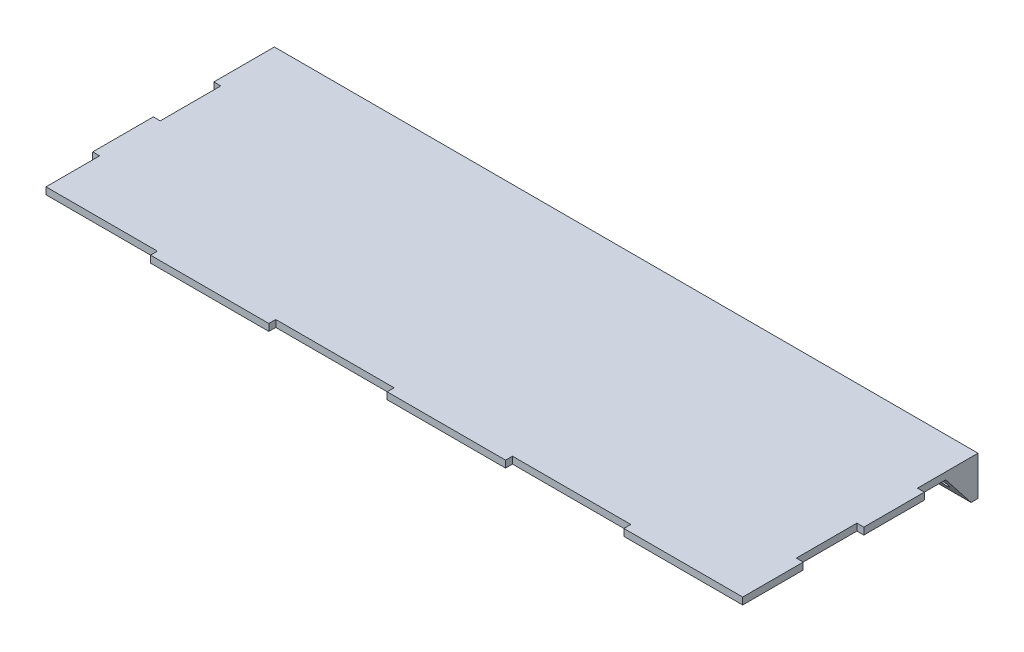
from build123d import *

# Parameters (mm, degrees)
EXTRUDE_1_DEPTH     = 3
SKETCH_3_W          = 51.3
SKETCH_3_H          = 3
CUT_EXTRUDE_2_DEPTH = 3
SKETCH_4_W          = 4
SKETCH_4_H          = 28
SKETCH_4_W_2        = 14
SKETCH_4_H_2        = 14
EXTRUDE_2_DEPTH     = 14
CUT_EXTRUDE_3_DEPTH = 14
CUT_EXTRUDE_4_DEPTH = 14
CUT_EXTRUDE_5_DEPTH = 14
CUT_EXTRUDE_6_REACH = 216.55
SKETCH_9_R          = 2.5


with BuildPart() as part:
    # Эскиз1 → Бобышка-Вытянуть1 (new body)
    with BuildSketch(Plane(origin=(0, 0, 0), x_dir=(1, 0, 0), z_dir=(0, 1, 0))):
        Polygon((-121.424018304, 15.144551695), (-121.424018304, 41.394551695), (183.575981696, 41.394551695), (183.575981696, 15.144551695), (186.575981696, 15.144551695), (186.575981696, -11.105448305), (183.575981696, -11.105448305), (183.575981696, -37.355448305), (186.575981696, -37.355448305), (186.575981696, -63.605448305), (-118.424018304, -63.605448305), (-118.424018304, -37.355448305), (-121.424018304, -37.355448305), (-121.424018304, -11.105448305), (-118.424018304, -11.105448305), (-118.424018304, 15.144551695), align=None)
    extrude(amount=EXTRUDE_1_DEPTH)

    # Эскиз3 → Вырез-Вытянуть2 (cut)
    with BuildSketch(Plane(origin=(0, 3, 0), x_dir=(1, 0, 0), z_dir=(0, 1, 0))):
        with Locations((-95.774018304, -62.105448305)):
            Rectangle(SKETCH_3_W, SKETCH_3_H)
        with Locations((6.825981696, -62.105448305)):
            Rectangle(SKETCH_3_W, SKETCH_3_H)
        with Locations((109.425981696, -62.105448305)):
            Rectangle(SKETCH_3_W, SKETCH_3_H)
    extrude(amount=-CUT_EXTRUDE_2_DEPTH, mode=Mode.SUBTRACT)

    # Эскиз4 → Бобышка-Вытянуть2 (add)
    with BuildSketch(Plane.XZ):
        with Locations((27.575981696, -27.394551695)):
            Rectangle(SKETCH_4_W, SKETCH_4_H)
        with Locations((-111.424018304, -34.394551695)):
            Rectangle(SKETCH_4_W_2, SKETCH_4_H_2)
        with Locations((176.575981696, -34.394551695)):
            Rectangle(SKETCH_4_W_2, SKETCH_4_H_2)
        with Locations((37.575981696, -27.394551695)):
            Rectangle(SKETCH_4_W, SKETCH_4_H)
    extrude(amount=EXTRUDE_2_DEPTH)

    # Эскиз6 → Вырез-Вытянуть3 (cut)
    with BuildSketch(Plane(origin=(39.575981696, 0, 0), x_dir=(0, 0, -1), z_dir=(1, 0, 0))):
        Polygon((13.394551695, -14), (13.394551695, 0), (38.394551695, -14), align=None)
    extrude(amount=-CUT_EXTRUDE_3_DEPTH, mode=Mode.SUBTRACT)

    # Эскиз7 → Вырез-Вытянуть4 (cut)
    with BuildSketch(Plane(origin=(183.575981696, 0, 0), x_dir=(0, 0, -1), z_dir=(1, 0, 0))):
        Polygon((27.394551695, -14), (27.394551695, 0), (38.394551695, -14), align=None)
    extrude(amount=-CUT_EXTRUDE_4_DEPTH, mode=Mode.SUBTRACT)

    # Эскиз8 → Вырез-Вытянуть5 (cut)
    with BuildSketch(Plane(origin=(-104.424018304, 0, 0), x_dir=(0, 0, -1), z_dir=(1, 0, 0))):
        Polygon((27.394551695, -14), (27.394551695, 0), (38.394551695, -14), align=None)
    extrude(amount=-CUT_EXTRUDE_5_DEPTH, mode=Mode.SUBTRACT)

    # Вырез-Вытянуть6: up to this plane
    cut_extrude_6_end = Plane(origin=(169.575981696, -14, -38.394551695), z_dir=(0, 0.6178215519319037, -0.7863183388224225))
    # Эскиз9 → Вырез-Вытянуть6 (cut, up to the surface)
    with BuildSketch(Plane(origin=(0, 0, -41.394551695), x_dir=(-1, 0, 0), z_dir=(0, 0, -1)), mode=Mode.PRIVATE) as cut_extrude_6_sk1:
        with Locations((-176.575981696, -7)):
            Circle(SKETCH_9_R)
    cut_extrude_6_tool1 = split(extrude(cut_extrude_6_sk1.sketch, amount=-CUT_EXTRUDE_6_REACH, mode=Mode.PRIVATE), bisect_by=cut_extrude_6_end, keep=Keep.BOTH, mode=Mode.PRIVATE)
    add(cut_extrude_6_tool1.solids().sort_by_distance((176.575982, -7, -41.394552))[0], mode=Mode.SUBTRACT)
    # Эскиз9 → Вырез-Вытянуть6 (cut, up to the surface)
    with BuildSketch(Plane(origin=(0, 0, -41.394551695), x_dir=(-1, 0, 0), z_dir=(0, 0, -1)), mode=Mode.PRIVATE) as cut_extrude_6_sk2:
        with Locations((111.424018304, -7)):
            Circle(SKETCH_9_R)
    cut_extrude_6_tool2 = split(extrude(cut_extrude_6_sk2.sketch, amount=-CUT_EXTRUDE_6_REACH, mode=Mode.PRIVATE), bisect_by=cut_extrude_6_end, keep=Keep.BOTH, mode=Mode.PRIVATE)
    add(cut_extrude_6_tool2.solids().sort_by_distance((-111.424018, -7, -41.394552))[0], mode=Mode.SUBTRACT)


solid = part.part
